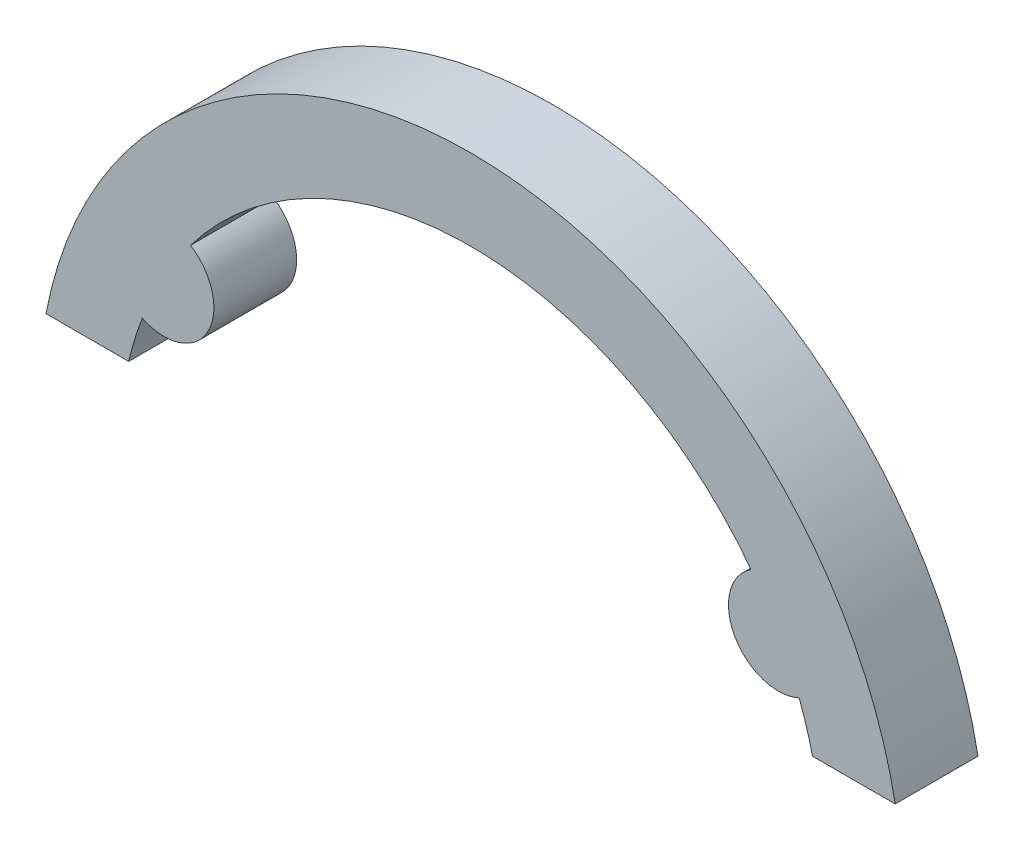
from build123d import *

# Parameters (mm, degrees)
BOSS_EXTRUDE6_DEPTH = 9.955320875


with BuildPart() as part:
    # Sketch1 → Boss-Extrude6 (new body)
    with BuildSketch(Plane.XY):
        with BuildLine():
            Line((-51.139816159, 9.78390553), (-41.19267445, 9.782935976))
            ThreePointArc((-41.19267445, 9.782935976), (-40.46615036, 12.469308879), (-39.564350519, 15.102024906))
            ThreePointArc((-39.564350519, 15.102024906), (-31.695161559, 17.596213673), (-33.764455715, 25.587654982))
            ThreePointArc((-33.764455715, 25.587654982), (-0.032994911, 42.351160958), (33.670827225, 25.532155221))
            ThreePointArc((33.670827225, 25.532155221), (31.692118999, 17.608927269), (39.44794108, 15.051574876))
            ThreePointArc((39.44794108, 15.051574876), (40.338215404, 12.444464282), (41.056685691, 9.784875128))
            Line((41.056685691, 9.784875128), (51.004283921, 9.78390553))
            ThreePointArc((51.004283921, 9.78390553), (-0.067766119, 52.083843354), (-51.139816159, 9.78390553))
        make_face()
    extrude(amount=BOSS_EXTRUDE6_DEPTH)


solid = part.part
